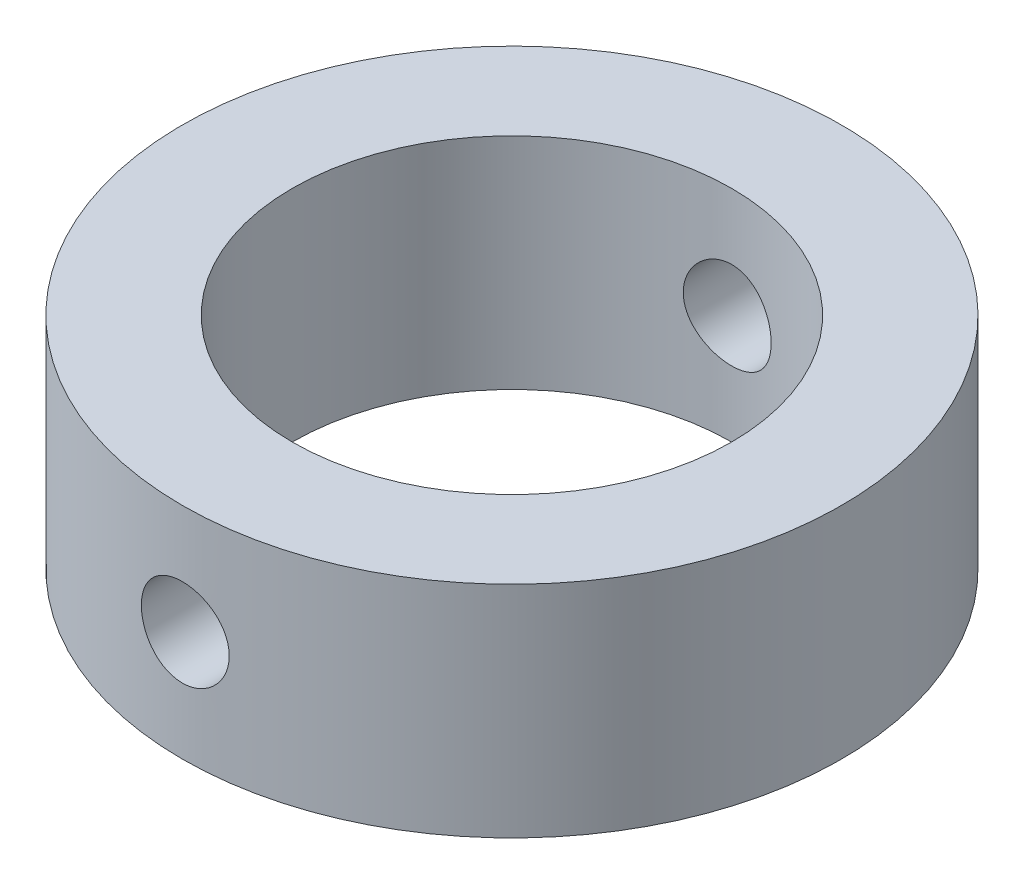
from build123d import *

# Parameters (mm, degrees)
CROQUIS1_R              = 22.5
CROQUIS1_R_2            = 15
SALIENTE_EXTRUIR1_DEPTH = 15
CROQUIS2_R              = 3
CORTAR_EXTRUIR1_DEPTH   = 30


with BuildPart() as part:
    # Croquis1 → Saliente-Extruir1 (new body)
    with BuildSketch(Plane(origin=(0, 0, 0), x_dir=(1, 0, 0), z_dir=(0, 1, 0))):
        with Locations(Location((0, 0, 0), (0, 0, 270))):
            Circle(CROQUIS1_R)
        with Locations(Location((0, 0, 0), (0, 0, 270))):
            Circle(CROQUIS1_R_2, mode=Mode.SUBTRACT)
    extrude(amount=SALIENTE_EXTRUIR1_DEPTH)

    # Croquis2 → Cortar-Extruir1 (cut, symmetric)
    with BuildSketch(Plane.XY):
        with Locations((0, 7.5)):
            Circle(CROQUIS2_R)
    extrude(amount=CORTAR_EXTRUIR1_DEPTH, both=True, mode=Mode.SUBTRACT)


solid = part.part
